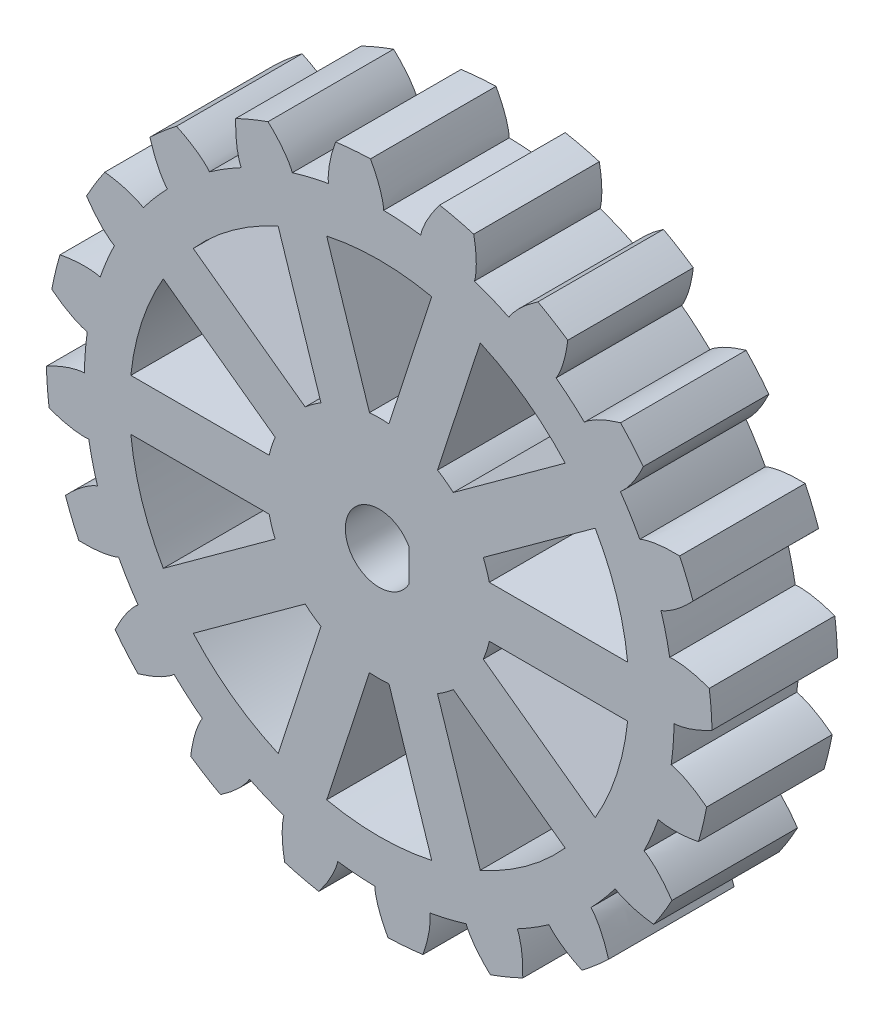
from build123d import *

# Parameters (mm, degrees)
SKETCH11_R          = 23.485
BOSS_EXTRUDE6_DEPTH = 10
BOSS_EXTRUDE7_START = -10
BOSS_EXTRUDE7_DEPTH = 10
CIRPATTERN2_COUNT   = 20
CUT_EXTRUDE2_DEPTH  = 10
CUT_EXTRUDE3_DEPTH  = 39.798369163
BOSS_EXTRUDE9_START = -10
SKETCH16_R          = 9
BOSS_EXTRUDE9_DEPTH = 20
SKETCH17_R          = 1
CUT_EXTRUDE4_DEPTH  = 20


with BuildPart() as part:
    # Sketch11 → Boss-Extrude6 (new body)
    with BuildSketch(Plane.XY):
        Circle(SKETCH11_R)
    extrude(amount=BOSS_EXTRUDE6_DEPTH)


with BuildPart() as boss_extrude7_tool:
    # Sketch12 → Boss-Extrude7 (new body)
    with BuildSketch(Plane.XY.offset(10).offset(BOSS_EXTRUDE7_START)):
        with BuildLine():
            ThreePointArc((-0.698714194, 26.507672824), (-2.092024725, 26.434226915), (-3.479543332, 26.287595901))
            add(Edge.make_bspline(
                [(-4.041867927, 23.134574756), (-4.062181435, 23.282433042), (-4.067795833, 23.589740221), (-4.031271904, 24.109524816), (-3.930902651, 24.745218006), (-3.750480819, 25.493536499), (-3.577402484, 26.021194553), (-3.479543332, 26.287595901)],
                knots=[0, 0, 0, 0, 0.099095848, 0.203819716, 0.346131534, 0.526410714, 0.715000767, 0.715000767, 0.715000767, 0.715000767], degree=3))
            ThreePointArc((-4.041867927, 23.134574756), (-1.852827397, 23.411797798), (0.352568917, 23.482353814))
            add(Edge.make_bspline(
                [(0.352568917, 23.482353814), (0.349371987, 23.631566719), (0.306578203, 23.935931493), (0.188748737, 24.443500444), (-0.010363268, 25.05549246), (-0.306246859, 25.766115782), (-0.560169293, 26.259980671), (-0.698714194, 26.507672824)],
                knots=[0, 0, 0, 0, 0.099095848, 0.203819716, 0.346131534, 0.526410714, 0.715000767, 0.715000767, 0.715000767, 0.715000767], degree=3))
        make_face()
    boss_extrude7 = extrude(amount=BOSS_EXTRUDE7_DEPTH)


with BuildPart() as part_1:
    add(part.part)


with BuildPart() as part_2:
    # Boss-Extrude7: joined with boss_extrude7_tool
    add(part_1.part.fuse(boss_extrude7_tool.part, tol=0.00001))

    # CirPattern2: Boss-Extrude7 ×20 about axis
    cirpattern2_axis = Axis((0, 0, 0), (0, 0, -1))
    for i in range(1, CIRPATTERN2_COUNT):
        add(boss_extrude7.rotate(cirpattern2_axis, i * 360 / CIRPATTERN2_COUNT))

    # Sketch13 → Cut-Extrude2 (cut)
    with BuildSketch(Plane.XY.offset(10)):
        with BuildLine():
            Line((2.45, 1.134680572), (2.45, -1.134680572))
            ThreePointArc((2.45, -1.134680572), (-2.7, 0), (2.45, 1.134680572))
        make_face()
    extrude(amount=-CUT_EXTRUDE2_DEPTH, mode=Mode.SUBTRACT)

    # Sketch14 → Cut-Extrude3 (cut, through all)
    with BuildSketch(Plane(origin=(0, 0, 0), x_dir=(-1, 0, 0), z_dir=(0, 0, -1))):
        with BuildLine():
            Line((-7.360141242, 2.836457816), (-17.199451215, 9.985134958))
            ThreePointArc((-17.199451215, 9.985134958), (-18.914408715, 6.145663934), (-19.783763397, 2.0314399))
            Line((-19.783763397, 2.0314399), (-7.621707419, 2.0314399))
            ThreePointArc((-7.621707419, 2.0314399), (-7.501730519, 2.437460002), (-7.360141242, 2.836457816))
        make_face()
        with BuildLine():
            Line((-7.621707419, -2.0314399), (-19.783763397, -2.0314399))
            ThreePointArc((-19.783763397, -2.0314399), (-18.914408715, -6.145663934), (-17.199451215, -9.985134958))
            Line((-17.199451215, -9.985134958), (-7.360141242, -2.836457816))
            ThreePointArc((-7.360141242, -2.836457816), (-7.501730519, -2.437460002), (-7.621707419, -2.0314399))
        make_face()
        with BuildLine():
            Line((-4.972040414, 6.12339662), (-14.811350387, 13.272073762))
            ThreePointArc((-14.811350387, 13.272073762), (-11.689747463, 16.089557063), (-8.045533257, 18.187727644))
            Line((-8.045533257, 18.187727644), (-4.287251273, 6.620925054))
            ThreePointArc((-4.287251273, 6.620925054), (-4.636324435, 6.38135313), (-4.972040414, 6.12339662))
        make_face()
        with BuildLine():
            Line((-0.423222965, 7.876423958), (-4.181504948, 19.443226548))
            ThreePointArc((-4.181504948, 19.443226548), (0, 19.887786258), (4.181504948, 19.443226548))
            Line((4.181504948, 19.443226548), (0.423222965, 7.876423958))
            ThreePointArc((0.423222965, 7.876423958), (0, 7.887786258), (-0.423222965, 7.876423958))
        make_face()
        with BuildLine():
            Line((4.287251273, 6.620925054), (8.045533257, 18.187727644))
            ThreePointArc((8.045533257, 18.187727644), (11.689747463, 16.089557063), (14.811350387, 13.272073762))
            Line((14.811350387, 13.272073762), (4.972040414, 6.12339662))
            ThreePointArc((4.972040414, 6.12339662), (4.636324435, 6.38135313), (4.287251273, 6.620925054))
        make_face()
        with BuildLine():
            Line((7.360141242, 2.836457816), (17.199451215, 9.985134958))
            ThreePointArc((17.199451215, 9.985134958), (18.914408715, 6.145663934), (19.783763397, 2.0314399))
            Line((19.783763397, 2.0314399), (7.621707419, 2.0314399))
            ThreePointArc((7.621707419, 2.0314399), (7.501730519, 2.437460002), (7.360141242, 2.836457816))
        make_face()
        with BuildLine():
            Line((7.621707419, -2.0314399), (19.783763397, -2.0314399))
            ThreePointArc((19.783763397, -2.0314399), (18.914408715, -6.145663934), (17.199451215, -9.985134958))
            Line((17.199451215, -9.985134958), (7.360141242, -2.836457816))
            ThreePointArc((7.360141242, -2.836457816), (7.501730519, -2.437460002), (7.621707419, -2.0314399))
        make_face()
        with BuildLine():
            Line((4.972040414, -6.12339662), (14.811350387, -13.272073762))
            ThreePointArc((14.811350387, -13.272073762), (11.689747463, -16.089557063), (8.045533257, -18.187727644))
            Line((8.045533257, -18.187727644), (4.287251273, -6.620925054))
            ThreePointArc((4.287251273, -6.620925054), (4.636324435, -6.38135313), (4.972040414, -6.12339662))
        make_face()
        with BuildLine():
            Line((0.423222965, -7.876423958), (4.181504948, -19.443226548))
            ThreePointArc((4.181504948, -19.443226548), (0, -19.887786258), (-4.181504948, -19.443226548))
            Line((-4.181504948, -19.443226548), (-0.423222965, -7.876423958))
            ThreePointArc((-0.423222965, -7.876423958), (0, -7.887786258), (0.423222965, -7.876423958))
        make_face()
        with BuildLine():
            Line((-4.287251273, -6.620925054), (-8.045533257, -18.187727644))
            ThreePointArc((-8.045533257, -18.187727644), (-11.689747463, -16.089557063), (-14.811350387, -13.272073762))
            Line((-14.811350387, -13.272073762), (-4.972040414, -6.12339662))
            ThreePointArc((-4.972040414, -6.12339662), (-4.636324435, -6.38135313), (-4.287251273, -6.620925054))
        make_face()
    extrude(amount=-CUT_EXTRUDE3_DEPTH, mode=Mode.SUBTRACT)

    # Sketch16 → Boss-Extrude9 (add)
    with BuildSketch(Plane(origin=(0, 0, 0), x_dir=(-1, 0, 0), z_dir=(0, 0, -1)).offset(BOSS_EXTRUDE9_START)):
        Circle(SKETCH16_R)
        with BuildLine():
            Line((-2.375, 1.284279954), (-2.375, -1.284279954))
            ThreePointArc((-2.375, -1.284279954), (2.7, 0), (-2.375, 1.284279954))
        make_face(mode=Mode.SUBTRACT)
    extrude(amount=BOSS_EXTRUDE9_DEPTH)

    # Sketch17 → Cut-Extrude4 (cut)
    with BuildSketch(Plane.ZY.offset(-2.375)):
        with Locations((-5, 0)):
            Circle(SKETCH17_R)
    extrude(amount=-CUT_EXTRUDE4_DEPTH, mode=Mode.SUBTRACT)


solid = part_2.part
